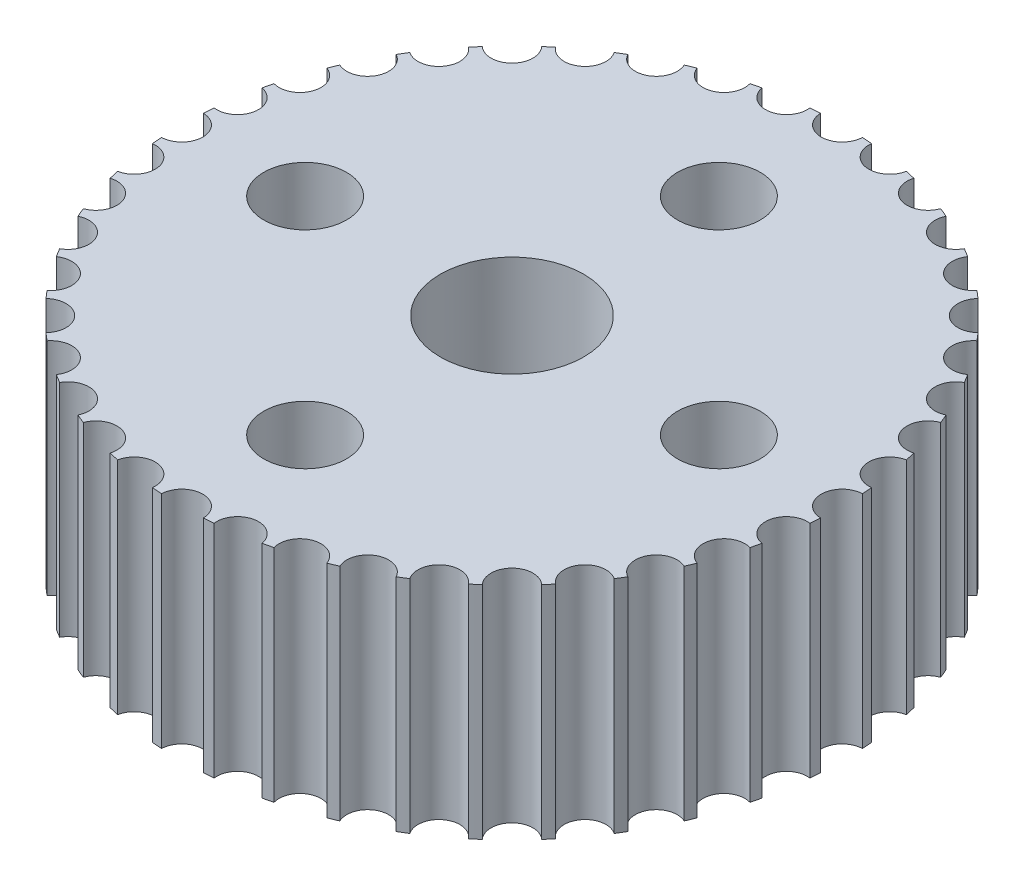
from build123d import *

# Parameters (mm, degrees)
BOSS_EXTRUDE1_DEPTH = 8
SKETCH4_R           = 2.6
CUT_EXTRUDE1_DEPTH  = 23
SKETCH5_R           = 1.5
CUT_EXTRUDE2_DEPTH  = 19.692452066


with BuildPart() as part:
    # Sketch1 → Boss-Extrude1 (new body)
    with BuildSketch(Plane(origin=(0, 0, 0), x_dir=(1, 0, 0), z_dir=(0, 1, 0))):
        with BuildLine():
            ThreePointArc((-2.619011045, 11.679969227), (-2.794341005, 11.639267947), (-2.969039138, 11.595934917))
            ThreePointArc((-2.969039138, 11.595934917), (-3.464080507, 10.661343548), (-4.413916411, 11.126465832))
            ThreePointArc((-4.413916411, 11.126465832), (-4.580720685, 11.058838004), (-4.746489215, 10.988709666))
            ThreePointArc((-4.746489215, 10.988709666), (-5.089233502, 9.988183136), (-6.100136506, 10.298991922))
            ThreePointArc((-6.100136506, 10.298991922), (-6.25430782, 10.206102767), (-6.407064974, 10.110905915))
            ThreePointArc((-6.407064974, 10.110905915), (-6.589072678, 9.069080507), (-7.636150994, 9.21792265))
            ThreePointArc((-7.636150994, 9.21792265), (-7.773893139, 9.102059408), (-7.909877531, 8.984138103))
            ThreePointArc((-7.909877531, 8.984138103), (-7.926667017, 7.926667017), (-8.984138103, 7.909877531))
            ThreePointArc((-8.984138103, 7.909877531), (-9.102059408, 7.773893139), (-9.21792265, 7.636150994))
            ThreePointArc((-9.21792265, 7.636150994), (-9.069080507, 6.589072678), (-10.110905915, 6.407064974))
            ThreePointArc((-10.110905915, 6.407064974), (-10.206102767, 6.25430782), (-10.298991922, 6.100136506))
            ThreePointArc((-10.298991922, 6.100136506), (-9.988183136, 5.089233502), (-10.988709666, 4.746489215))
            ThreePointArc((-10.988709666, 4.746489215), (-11.058838004, 4.580720685), (-11.126465832, 4.413916411))
            ThreePointArc((-11.126465832, 4.413916411), (-10.661343548, 3.464080507), (-11.595934917, 2.969039138))
            ThreePointArc((-11.595934917, 2.969039138), (-11.639267947, 2.794341005), (-11.679969227, 2.619011045))
            ThreePointArc((-11.679969227, 2.619011045), (-11.071986298, 1.753630353), (-11.917629765, 1.118481464))
            ThreePointArc((-11.917629765, 1.118481464), (-11.933100485, 0.939155376), (-11.945873016, 0.759616935))
            ThreePointArc((-11.945873016, 0.759616935), (-11.21, 0), (-11.945873016, -0.759616935))
            ThreePointArc((-11.945873016, -0.759616935), (-11.933100485, -0.939155376), (-11.917629765, -1.118481464))
            ThreePointArc((-11.917629765, -1.118481464), (-11.071986298, -1.753630353), (-11.679969227, -2.619011045))
            ThreePointArc((-11.679969227, -2.619011045), (-11.639267947, -2.794341005), (-11.595934917, -2.969039138))
            ThreePointArc((-11.595934917, -2.969039138), (-10.661343548, -3.464080507), (-11.126465832, -4.413916411))
            ThreePointArc((-11.126465832, -4.413916411), (-11.058838004, -4.580720685), (-10.988709666, -4.746489215))
            ThreePointArc((-10.988709666, -4.746489215), (-9.988183136, -5.089233502), (-10.298991922, -6.100136506))
            ThreePointArc((-10.298991922, -6.100136506), (-10.206102767, -6.25430782), (-10.110905915, -6.407064974))
            ThreePointArc((-10.110905915, -6.407064974), (-9.069080507, -6.589072678), (-9.21792265, -7.636150994))
            ThreePointArc((-9.21792265, -7.636150994), (-9.102059408, -7.773893139), (-8.984138103, -7.909877531))
            ThreePointArc((-8.984138103, -7.909877531), (-7.926667017, -7.926667017), (-7.909877531, -8.984138103))
            ThreePointArc((-7.909877531, -8.984138103), (-7.773893139, -9.102059408), (-7.636150994, -9.21792265))
            ThreePointArc((-7.636150994, -9.21792265), (-6.589072678, -9.069080507), (-6.407064974, -10.110905915))
            ThreePointArc((-6.407064974, -10.110905915), (-6.25430782, -10.206102767), (-6.100136506, -10.298991922))
            ThreePointArc((-6.100136506, -10.298991922), (-5.089233502, -9.988183136), (-4.746489215, -10.988709666))
            ThreePointArc((-4.746489215, -10.988709666), (-4.580720685, -11.058838004), (-4.413916411, -11.126465832))
            ThreePointArc((-4.413916411, -11.126465832), (-3.464080507, -10.661343548), (-2.969039138, -11.595934917))
            ThreePointArc((-2.969039138, -11.595934917), (-2.794341005, -11.639267947), (-2.619011045, -11.679969227))
            ThreePointArc((-2.619011045, -11.679969227), (-1.753630353, -11.071986298), (-1.118481464, -11.917629765))
            ThreePointArc((-1.118481464, -11.917629765), (-0.939155376, -11.933100485), (-0.759616935, -11.945873016))
            ThreePointArc((-0.759616935, -11.945873016), (0, -11.21), (0.759616935, -11.945873016))
            ThreePointArc((0.759616935, -11.945873016), (0.939155376, -11.933100485), (1.118481464, -11.917629765))
            ThreePointArc((1.118481464, -11.917629765), (1.753630353, -11.071986298), (2.619011045, -11.679969227))
            ThreePointArc((2.619011045, -11.679969227), (2.794341005, -11.639267947), (2.969039138, -11.595934917))
            ThreePointArc((2.969039138, -11.595934917), (3.464080507, -10.661343548), (4.413916411, -11.126465832))
            ThreePointArc((4.413916411, -11.126465832), (4.580720685, -11.058838004), (4.746489215, -10.988709666))
            ThreePointArc((4.746489215, -10.988709666), (5.089233502, -9.988183136), (6.100136506, -10.298991922))
            ThreePointArc((6.100136506, -10.298991922), (6.25430782, -10.206102767), (6.407064974, -10.110905915))
            ThreePointArc((6.407064974, -10.110905915), (6.589072678, -9.069080507), (7.636150994, -9.21792265))
            ThreePointArc((7.636150994, -9.21792265), (7.773893139, -9.102059408), (7.909877531, -8.984138103))
            ThreePointArc((7.909877531, -8.984138103), (7.926667017, -7.926667017), (8.984138103, -7.909877531))
            ThreePointArc((8.984138103, -7.909877531), (9.102059408, -7.773893139), (9.21792265, -7.636150994))
            ThreePointArc((9.21792265, -7.636150994), (9.069080507, -6.589072678), (10.110905915, -6.407064974))
            ThreePointArc((10.110905915, -6.407064974), (10.206102767, -6.25430782), (10.298991922, -6.100136506))
            ThreePointArc((10.298991922, -6.100136506), (9.988183136, -5.089233502), (10.988709666, -4.746489215))
            ThreePointArc((10.988709666, -4.746489215), (11.058838004, -4.580720685), (11.126465832, -4.413916411))
            ThreePointArc((11.126465832, -4.413916411), (10.661343548, -3.464080507), (11.595934917, -2.969039138))
            ThreePointArc((11.595934917, -2.969039138), (11.639267947, -2.794341005), (11.679969227, -2.619011045))
            ThreePointArc((11.679969227, -2.619011045), (11.071986298, -1.753630353), (11.917629765, -1.118481464))
            ThreePointArc((11.917629765, -1.118481464), (11.933100485, -0.939155376), (11.945873016, -0.759616935))
            ThreePointArc((11.945873016, -0.759616935), (11.21, 0), (11.945873016, 0.759616935))
            ThreePointArc((11.945873016, 0.759616935), (11.933100485, 0.939155376), (11.917629765, 1.118481464))
            ThreePointArc((11.917629765, 1.118481464), (11.071986298, 1.753630353), (11.679969227, 2.619011045))
            ThreePointArc((11.679969227, 2.619011045), (11.639267947, 2.794341005), (11.595934917, 2.969039138))
            ThreePointArc((11.595934917, 2.969039138), (10.661343548, 3.464080507), (11.126465832, 4.413916411))
            ThreePointArc((11.126465832, 4.413916411), (11.058838004, 4.580720685), (10.988709666, 4.746489215))
            ThreePointArc((10.988709666, 4.746489215), (9.988183136, 5.089233502), (10.298991922, 6.100136506))
            ThreePointArc((10.298991922, 6.100136506), (10.206102767, 6.25430782), (10.110905915, 6.407064974))
            ThreePointArc((10.110905915, 6.407064974), (9.069080507, 6.589072678), (9.21792265, 7.636150994))
            ThreePointArc((9.21792265, 7.636150994), (9.102059408, 7.773893139), (8.984138103, 7.909877531))
            ThreePointArc((8.984138103, 7.909877531), (7.926667017, 7.926667017), (7.909877531, 8.984138103))
            ThreePointArc((7.909877531, 8.984138103), (7.773893139, 9.102059408), (7.636150994, 9.21792265))
            ThreePointArc((7.636150994, 9.21792265), (6.589072678, 9.069080507), (6.407064974, 10.110905915))
            ThreePointArc((6.407064974, 10.110905915), (6.25430782, 10.206102767), (6.100136506, 10.298991922))
            ThreePointArc((6.100136506, 10.298991922), (5.089233502, 9.988183136), (4.746489215, 10.988709666))
            ThreePointArc((4.746489215, 10.988709666), (4.580720685, 11.058838004), (4.413916411, 11.126465832))
            ThreePointArc((4.413916411, 11.126465832), (3.464080507, 10.661343548), (2.969039138, 11.595934917))
            ThreePointArc((2.969039138, 11.595934917), (2.794341005, 11.639267947), (2.619011045, 11.679969227))
            ThreePointArc((2.619011045, 11.679969227), (1.753630353, 11.071986298), (1.118481464, 11.917629765))
            ThreePointArc((1.118481464, 11.917629765), (0.939155376, 11.933100485), (0.759616935, 11.945873016))
            ThreePointArc((0.759616935, 11.945873016), (0, 11.21), (-0.759616935, 11.945873016))
            ThreePointArc((-0.759616935, 11.945873016), (-0.939155376, 11.933100485), (-1.118481464, 11.917629765))
            ThreePointArc((-1.118481464, 11.917629765), (-1.753630353, 11.071986298), (-2.619011045, 11.679969227))
        make_face()
    extrude(amount=BOSS_EXTRUDE1_DEPTH)

    # Sketch4 → Cut-Extrude1 (cut)
    with BuildSketch(Plane.XZ):
        with Locations(Location((0, 0, 0), (0, 0, 270))):
            Circle(SKETCH4_R)
    extrude(amount=-CUT_EXTRUDE1_DEPTH, mode=Mode.SUBTRACT)

    # Sketch5 → Cut-Extrude2 (cut, through all)
    with BuildSketch(Plane.XZ):
        with Locations(Location((0, 7.5, 0), (0, 0, 270))):
            Circle(SKETCH5_R)
        with Locations(Location((7.5, 0, 0), (0, 0, 270))):
            Circle(SKETCH5_R)
        with Locations(Location((0, -7.5, 0), (0, 0, 270))):
            Circle(SKETCH5_R)
        with Locations(Location((-7.5, 0, 0), (0, 0, 270))):
            Circle(SKETCH5_R)
    extrude(amount=-CUT_EXTRUDE2_DEPTH, mode=Mode.SUBTRACT)


solid = part.part
